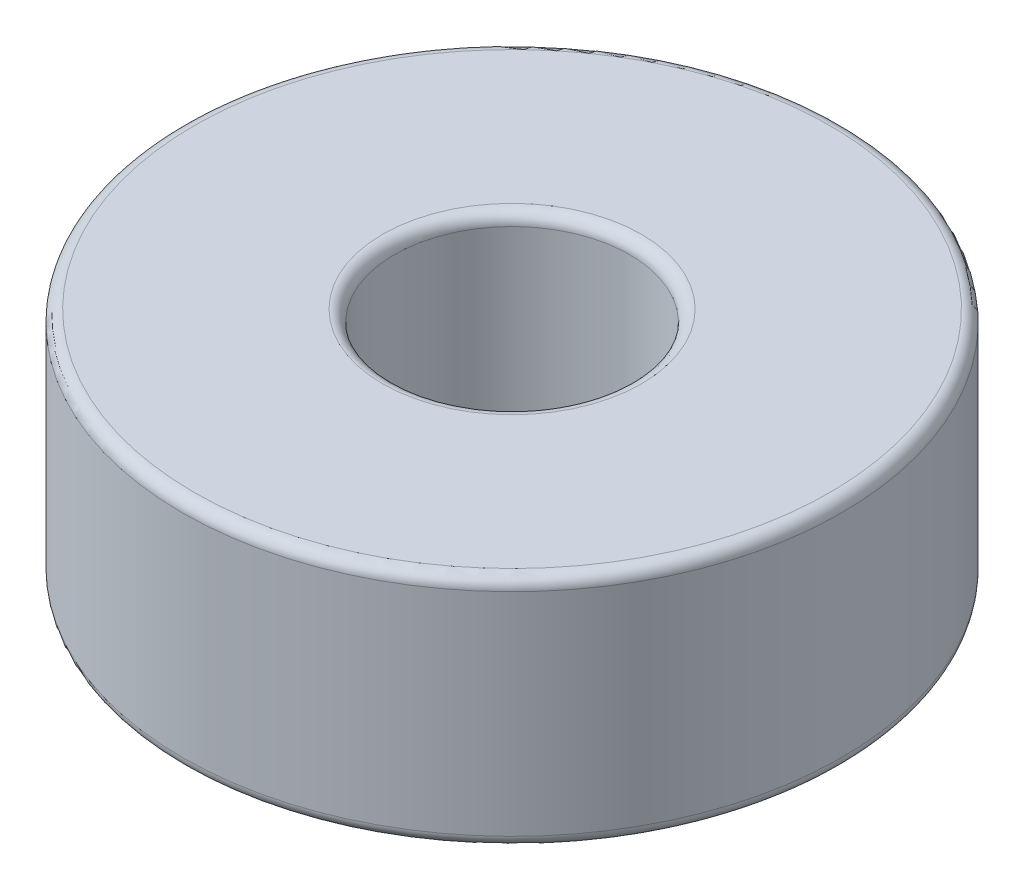
from build123d import *

# Parameters (mm, degrees)
SKETCH1_R           = 7
SKETCH1_R_2         = 2.5
BOSS_EXTRUDE1_DEPTH = 5
FILLET1_R           = 0.25


with BuildPart() as part:
    # Sketch1 → Boss-Extrude1 (new body)
    with BuildSketch(Plane(origin=(0, 0, 0), x_dir=(1, 0, 0), z_dir=(0, 1, 0))):
        with Locations(Location((0, 0, 0), (0, 0, 270))):
            Circle(SKETCH1_R)
        with Locations(Location((0, 0, 0), (0, 0, 270))):
            Circle(SKETCH1_R_2, mode=Mode.SUBTRACT)
    extrude(amount=BOSS_EXTRUDE1_DEPTH)

    # Fillet1
    fillet1_edges = [part.edges().sort_by_distance(p)[0] for p in [
        (0, 0, -7),
        (0, 5, -7),
        (0, 0, -2.5),
        (0, 5, -2.5),
    ]]
    fillet(fillet1_edges, radius=FILLET1_R)


solid = part.part
